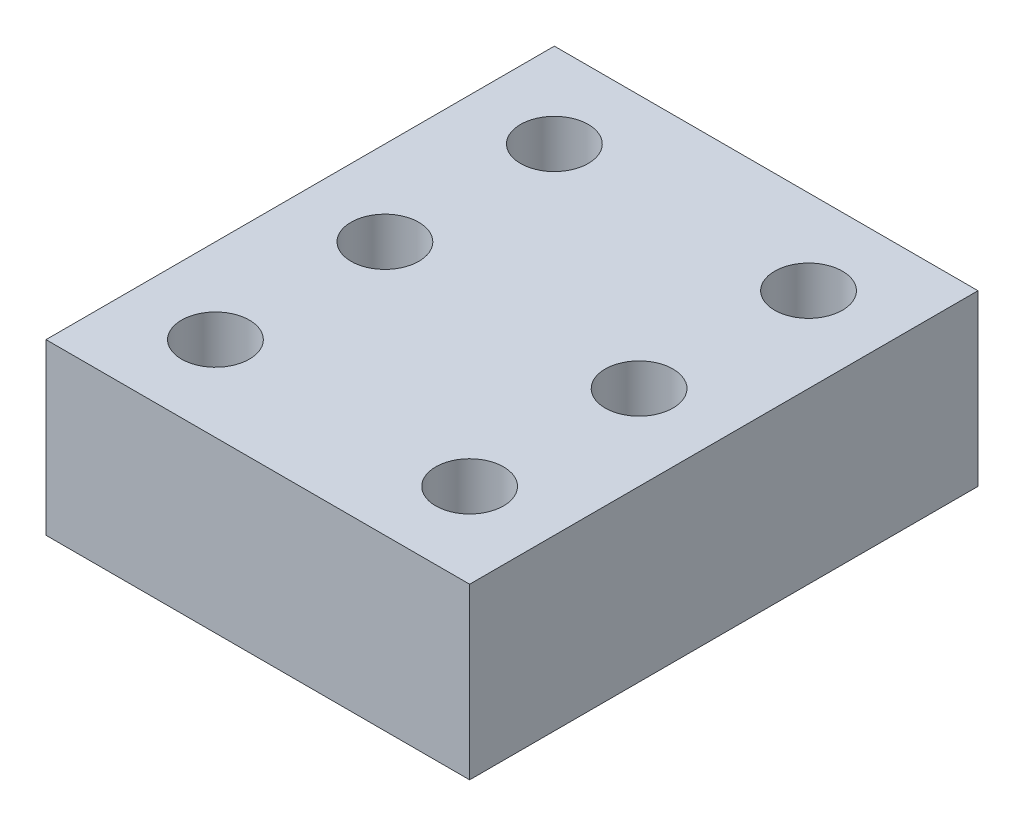
from build123d import *

# Parameters (mm, degrees)
SKETCH1_W           = 25
SKETCH1_H           = 30
SKETCH1_R           = 2
BOSS_EXTRUDE1_DEPTH = 10


with BuildPart() as part:
    # Sketch1 → Boss-Extrude1 (new body)
    with BuildSketch(Plane(origin=(0, 0, 0), x_dir=(1, 0, 0), z_dir=(0, 1, 0))):
        Rectangle(SKETCH1_W, SKETCH1_H)
        with Locations(Location((7.5, 0, 0), (0, 0, 270))):
            Circle(SKETCH1_R, mode=Mode.SUBTRACT)
        with Locations(Location((7.5, -10, 0), (0, 0, 270))):
            Circle(SKETCH1_R, mode=Mode.SUBTRACT)
        with Locations(Location((-7.5, -10, 0), (0, 0, 270))):
            Circle(SKETCH1_R, mode=Mode.SUBTRACT)
        with Locations(Location((-7.5, 0, 0), (0, 0, 270))):
            Circle(SKETCH1_R, mode=Mode.SUBTRACT)
        with Locations(Location((-7.5, 10, 0), (0, 0, 270))):
            Circle(SKETCH1_R, mode=Mode.SUBTRACT)
        with Locations(Location((7.5, 10, 0), (0, 0, 270))):
            Circle(SKETCH1_R, mode=Mode.SUBTRACT)
    extrude(amount=BOSS_EXTRUDE1_DEPTH)


solid = part.part
